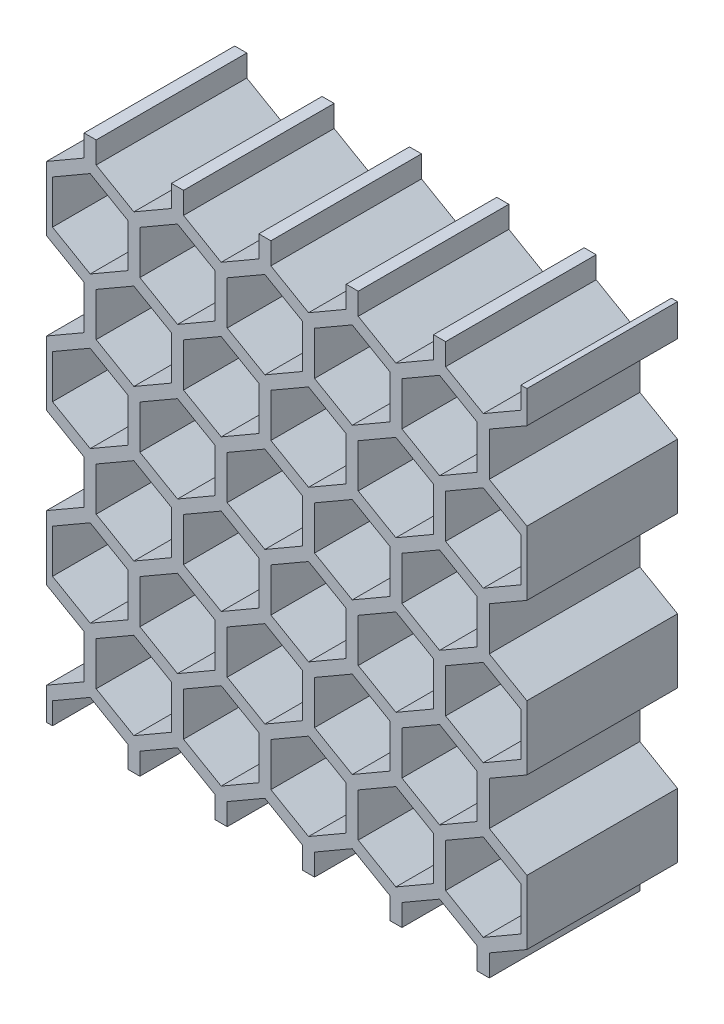
from build123d import *

# Parameters (mm, degrees)
BOSS_EXTRUDE1_DEPTH = 10


with BuildPart() as part:
    # Sketch1 → Boss-Extrude1 (new body)
    with BuildSketch(Plane.XY):
        Polygon((2.5, 1.443375673), (2.5, -1.443375673), (0, -2.886751346), (0, -5.022947342), (0.4, -5.022947342), (0.4, -3.579571669), (2.9, -2.136195996), (5.4, -3.579571669), (5.4, -5.022947342), (6.2, -5.022947342), (6.2, -3.579571669), (8.7, -2.136195996), (11.2, -3.579571669), (11.2, -5.022947342), (12, -5.022947342), (12, -3.579571669), (14.5, -2.136195996), (17, -3.579571669), (17, -5.022947342), (17.8, -5.022947342), (17.8, -3.579571669), (20.3, -2.136195996), (22.8, -3.579571669), (22.8, -5.022947342), (23.6, -5.022947342), (23.6, -3.579571669), (26.1, -2.136195996), (28.6, -3.579571669), (28.6, -5.022947342), (29.4, -5.022947342), (29.4, -3.579571669), (31.9, -2.136195996), (31.9, 2.130301312), (29.4, 3.573676985), (29.4, 6.460428331), (31.9, 7.903804004), (31.9, 12.170301312), (29.4, 13.613676985), (29.4, 16.500428331), (31.9, 17.943804004), (31.9, 22.210301312), (29.4, 23.653676985), (29.4, 26.540428331), (31.9, 27.983804004), (31.9, 30.12), (31.5, 30.12), (31.5, 28.676624327), (29, 27.233248654), (26.5, 28.676624327), (26.5, 30.12), (25.7, 30.12), (25.7, 28.676624327), (23.2, 27.233248654), (20.7, 28.676624327), (20.7, 30.12), (19.9, 30.12), (19.9, 28.676624327), (17.4, 27.233248654), (14.9, 28.676624327), (14.9, 30.12), (14.1, 30.12), (14.1, 28.676624327), (11.6, 27.233248654), (9.1, 28.676624327), (9.1, 30.12), (8.3, 30.12), (8.3, 28.676624327), (5.8, 27.233248654), (3.3, 28.676624327), (3.3, 30.12), (2.5, 30.12), (2.5, 28.676624327), (0, 27.233248654), (0, 22.966751346), (2.5, 21.523375673), (2.5, 18.636624327), (0, 17.193248654), (0, 12.926751346), (2.5, 11.483375673), (2.5, 8.596624327), (0, 7.153248654), (0, 2.886751346), align=None)
        Polygon((8.3, 1.443375673), (8.3, -1.443375673), (5.8, -2.886751346), (3.3, -1.443375673), (3.3, 1.443375673), (5.8, 2.886751346), align=None, mode=Mode.SUBTRACT)
        Polygon((14.1, 1.443375673), (14.1, -1.443375673), (11.6, -2.886751346), (9.1, -1.443375673), (9.1, 1.443375673), (11.6, 2.886751346), align=None, mode=Mode.SUBTRACT)
        Polygon((5.4, 6.460428331), (5.4, 3.573676985), (2.9, 2.130301312), (0.4, 3.573676985), (0.4, 6.460428331), (2.9, 7.903804004), align=None, mode=Mode.SUBTRACT)
        Polygon((8.3, 11.483375673), (8.3, 8.596624327), (5.8, 7.153248654), (3.3, 8.596624327), (3.3, 11.483375673), (5.8, 12.926751346), align=None, mode=Mode.SUBTRACT)
        Polygon((11.2, 6.460428331), (11.2, 3.573676985), (8.7, 2.130301312), (6.2, 3.573676985), (6.2, 6.460428331), (8.7, 7.903804004), align=None, mode=Mode.SUBTRACT)
        Polygon((17, 6.460428331), (17, 3.573676985), (14.5, 2.130301312), (12, 3.573676985), (12, 6.460428331), (14.5, 7.903804004), align=None, mode=Mode.SUBTRACT)
        Polygon((14.1, 11.483375673), (14.1, 8.596624327), (11.6, 7.153248654), (9.1, 8.596624327), (9.1, 11.483375673), (11.6, 12.926751346), align=None, mode=Mode.SUBTRACT)
        Polygon((19.9, 1.443375673), (19.9, -1.443375673), (17.4, -2.886751346), (14.9, -1.443375673), (14.9, 1.443375673), (17.4, 2.886751346), align=None, mode=Mode.SUBTRACT)
        Polygon((25.7, 1.443375673), (25.7, -1.443375673), (23.2, -2.886751346), (20.7, -1.443375673), (20.7, 1.443375673), (23.2, 2.886751346), align=None, mode=Mode.SUBTRACT)
        Polygon((31.5, 1.443375673), (31.5, -1.443375673), (29, -2.886751346), (26.5, -1.443375673), (26.5, 1.443375673), (29, 2.886751346), align=None, mode=Mode.SUBTRACT)
        Polygon((22.8, 6.460428331), (22.8, 3.573676985), (20.3, 2.130301312), (17.8, 3.573676985), (17.8, 6.460428331), (20.3, 7.903804004), align=None, mode=Mode.SUBTRACT)
        Polygon((19.9, 11.483375673), (19.9, 8.596624327), (17.4, 7.153248654), (14.9, 8.596624327), (14.9, 11.483375673), (17.4, 12.926751346), align=None, mode=Mode.SUBTRACT)
        Polygon((25.7, 11.483375673), (25.7, 8.596624327), (23.2, 7.153248654), (20.7, 8.596624327), (20.7, 11.483375673), (23.2, 12.926751346), align=None, mode=Mode.SUBTRACT)
        Polygon((28.6, 6.460428331), (28.6, 3.573676985), (26.1, 2.130301312), (23.6, 3.573676985), (23.6, 6.460428331), (26.1, 7.903804004), align=None, mode=Mode.SUBTRACT)
        Polygon((31.5, 11.483375673), (31.5, 8.596624327), (29, 7.153248654), (26.5, 8.596624327), (26.5, 11.483375673), (29, 12.926751346), align=None, mode=Mode.SUBTRACT)
        Polygon((5.4, 16.500428331), (5.4, 13.613676985), (2.9, 12.170301312), (0.4, 13.613676985), (0.4, 16.500428331), (2.9, 17.943804004), align=None, mode=Mode.SUBTRACT)
        Polygon((8.3, 21.523375673), (8.3, 18.636624327), (5.8, 17.193248654), (3.3, 18.636624327), (3.3, 21.523375673), (5.8, 22.966751346), align=None, mode=Mode.SUBTRACT)
        Polygon((11.2, 16.500428331), (11.2, 13.613676985), (8.7, 12.170301312), (6.2, 13.613676985), (6.2, 16.500428331), (8.7, 17.943804004), align=None, mode=Mode.SUBTRACT)
        Polygon((17, 16.500428331), (17, 13.613676985), (14.5, 12.170301312), (12, 13.613676985), (12, 16.500428331), (14.5, 17.943804004), align=None, mode=Mode.SUBTRACT)
        Polygon((14.1, 21.523375673), (14.1, 18.636624327), (11.6, 17.193248654), (9.1, 18.636624327), (9.1, 21.523375673), (11.6, 22.966751346), align=None, mode=Mode.SUBTRACT)
        Polygon((5.4, 26.540428331), (5.4, 23.653676985), (2.9, 22.210301312), (0.4, 23.653676985), (0.4, 26.540428331), (2.9, 27.983804004), align=None, mode=Mode.SUBTRACT)
        Polygon((11.2, 26.540428331), (11.2, 23.653676985), (8.7, 22.210301312), (6.2, 23.653676985), (6.2, 26.540428331), (8.7, 27.983804004), align=None, mode=Mode.SUBTRACT)
        Polygon((17, 26.540428331), (17, 23.653676985), (14.5, 22.210301312), (12, 23.653676985), (12, 26.540428331), (14.5, 27.983804004), align=None, mode=Mode.SUBTRACT)
        Polygon((22.8, 16.500428331), (22.8, 13.613676985), (20.3, 12.170301312), (17.8, 13.613676985), (17.8, 16.500428331), (20.3, 17.943804004), align=None, mode=Mode.SUBTRACT)
        Polygon((19.9, 21.523375673), (19.9, 18.636624327), (17.4, 17.193248654), (14.9, 18.636624327), (14.9, 21.523375673), (17.4, 22.966751346), align=None, mode=Mode.SUBTRACT)
        Polygon((25.7, 21.523375673), (25.7, 18.636624327), (23.2, 17.193248654), (20.7, 18.636624327), (20.7, 21.523375673), (23.2, 22.966751346), align=None, mode=Mode.SUBTRACT)
        Polygon((28.6, 16.500428331), (28.6, 13.613676985), (26.1, 12.170301312), (23.6, 13.613676985), (23.6, 16.500428331), (26.1, 17.943804004), align=None, mode=Mode.SUBTRACT)
        Polygon((31.5, 21.523375673), (31.5, 18.636624327), (29, 17.193248654), (26.5, 18.636624327), (26.5, 21.523375673), (29, 22.966751346), align=None, mode=Mode.SUBTRACT)
        Polygon((22.8, 26.540428331), (22.8, 23.653676985), (20.3, 22.210301312), (17.8, 23.653676985), (17.8, 26.540428331), (20.3, 27.983804004), align=None, mode=Mode.SUBTRACT)
        Polygon((28.6, 26.540428331), (28.6, 23.653676985), (26.1, 22.210301312), (23.6, 23.653676985), (23.6, 26.540428331), (26.1, 27.983804004), align=None, mode=Mode.SUBTRACT)
    extrude(amount=BOSS_EXTRUDE1_DEPTH)


solid = part.part
